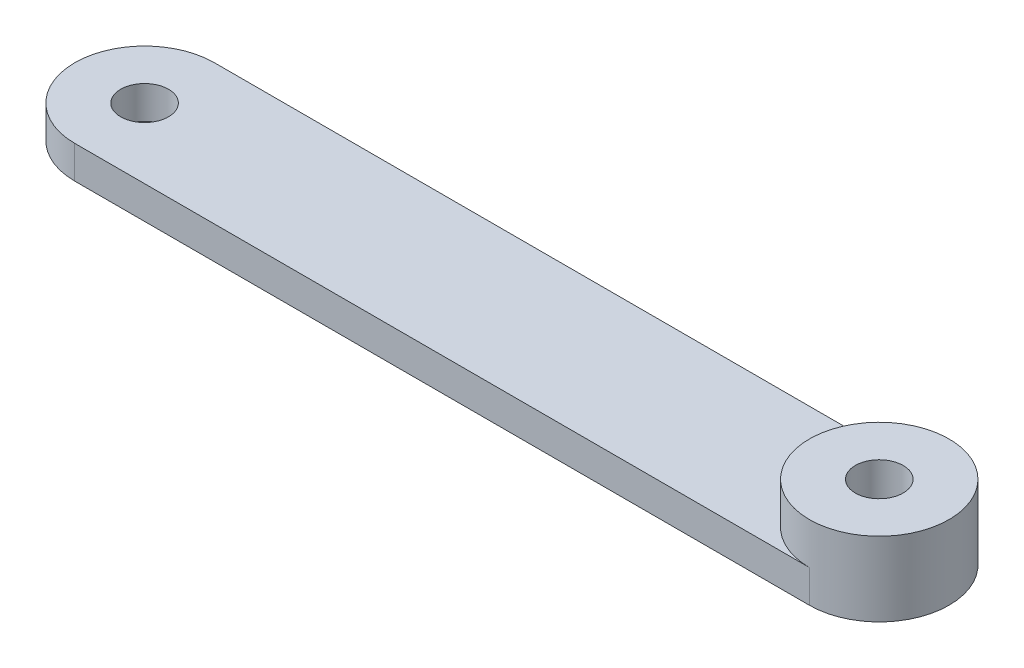
from build123d import *

# Parameters (mm, degrees)
BOSS_EXTRUDE1_DEPTH = 2.975
SKETCH2_R           = 2.175
CUT_EXTRUDE1_DEPTH  = 12.7
SKETCH3_R           = 2.175
BOSS_EXTRUDE2_DEPTH = 3.775


with BuildPart() as part:
    # Sketch1 → Boss-Extrude1 (new body)
    with BuildSketch(Plane(origin=(0, 0, 0), x_dir=(1, 0, 0), z_dir=(0, 1, 0))):
        with BuildLine():
            Line((-23.171929825, 5.625877193), (43.628070175, 5.625877193))
            ThreePointArc((43.628070175, 5.625877193), (49.978070175, -0.724122807), (43.628070175, -7.074122807))
            Line((43.628070175, -7.074122807), (-23.171929825, -7.074122807))
            ThreePointArc((-23.171929825, -7.074122807), (-29.521929825, -0.724122807), (-23.171929825, 5.625877193))
        make_face()
    extrude(amount=BOSS_EXTRUDE1_DEPTH)

    # Sketch2 → Cut-Extrude1 (cut)
    with BuildSketch(Plane(origin=(0, 2.975, 0), x_dir=(1, 0, 0), z_dir=(0, 1, 0))):
        with Locations(Location((-23.171929825, -0.724122807, 0), (0, 0, 270))):
            Circle(SKETCH2_R)
        with Locations(Location((43.628070175, -0.724122807, 0), (0, 0, 270))):
            Circle(SKETCH2_R)
    extrude(amount=-CUT_EXTRUDE1_DEPTH, mode=Mode.SUBTRACT)

    # Sketch3 → Boss-Extrude2 (add)
    with BuildSketch(Plane(origin=(0, 2.975, 0), x_dir=(1, 0, 0), z_dir=(0, 1, 0))):
        with BuildLine():
            ThreePointArc((43.628070175, 5.625877193), (49.978070175, -0.724122807), (43.628070175, -7.074122807))
            ThreePointArc((43.628070175, -7.074122807), (37.278070175, -0.724122807), (43.628070175, 5.625877193))
        make_face()
        with Locations(Location((43.628070175, -0.724122807, 0), (0, 0, 270))):
            Circle(SKETCH3_R, mode=Mode.SUBTRACT)
    extrude(amount=BOSS_EXTRUDE2_DEPTH)


solid = part.part
